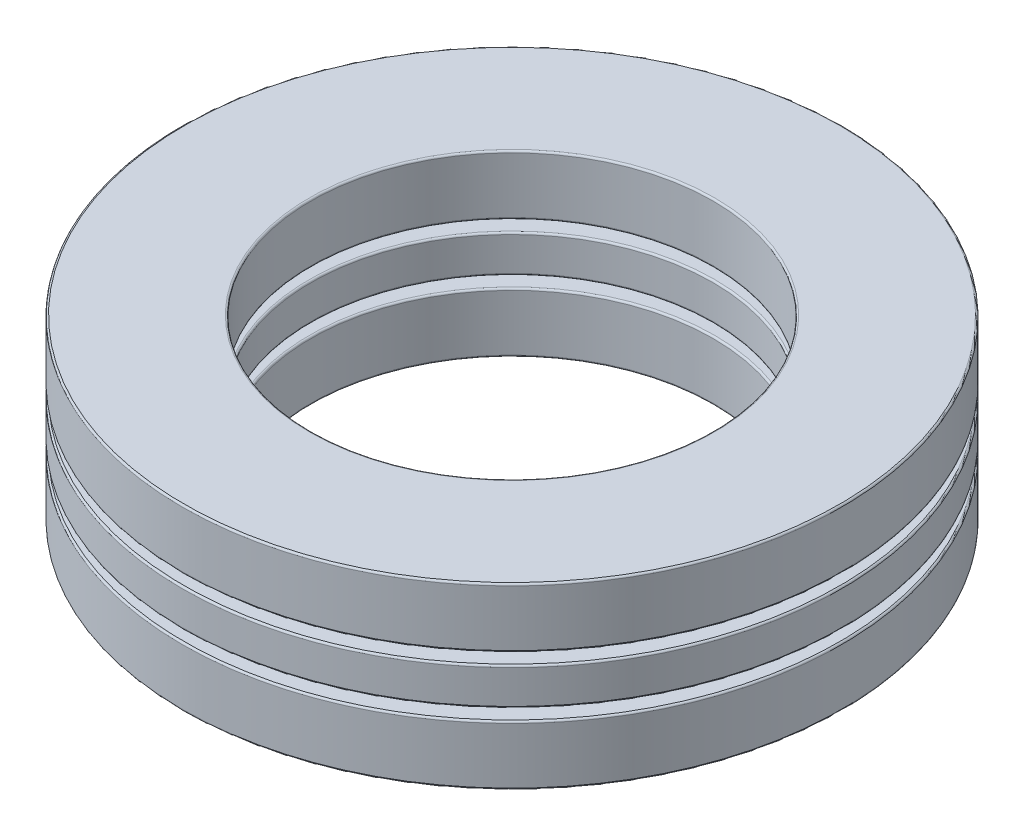
from build123d import *

# Parameters (mm, degrees)
SKETCH1_W         = 8
SKETCH1_H         = 2.314583334
CIRPATTERN1_COUNT = 10
CIRPATTERN1_ANGLE = 324
CIRPATTERN2_COUNT = 10
SKETCH4_W         = 8
SKETCH4_H         = 3.703333333
FILLET1_R         = 0.1111
FILLET2_R         = 0.1111
FILLET3_R         = 0.1111


with BuildPart() as part:
    # Sketch1 → Revolve1 (revolve)
    with BuildSketch(Plane(origin=(0, 0, 0), x_dir=(0, 0, -1), z_dir=(1, 0, 0)), mode=Mode.PRIVATE) as revolve1_sk:
        with Locations((-16.5, 0)):
            Rectangle(SKETCH1_W, SKETCH1_H)
    revolve(revolve1_sk.sketch.rotate(Axis((0, -5.555, 0), (0, 1, 0)), 180), axis=Axis((0, -5.555, 0), (0, 1, 0)))

    # Sketch3 → Cut-Revolve1 (revolve, cut)
    with BuildSketch(Plane(origin=(0, 0, 0), x_dir=(0, 0, -1), z_dir=(1, 0, 0))):
        with BuildLine():
            Line((-16.5, 1.851666667), (-16.5, -1.851666667))
            ThreePointArc((-16.5, -1.851666667), (-18.351666667, 0), (-16.5, 1.851666667))
        make_face()
    cut_revolve1 = revolve(axis=Axis((0, 1.851666667, 16.5), (0, -1, 0)), mode=Mode.SUBTRACT)

    # CirPattern2: Cut-Revolve1 ×10 about axis
    cirpattern2_axis = Axis((0, 0, 0), (0, 1, 0))
    for i in range(1, CIRPATTERN2_COUNT):
        add(cut_revolve1.rotate(cirpattern2_axis, i * 360 / CIRPATTERN2_COUNT), mode=Mode.SUBTRACT)

    # Fillet2
    fillet2_edges = [part.edges().sort_by_distance(p)[0] for p in [
        (0, 1.157291667, 20.5),
        (0, 1.157291667, 12.5),
        (0, -1.157291667, 12.5),
        (0, -1.157291667, 20.5),
    ]]
    fillet(fillet2_edges, radius=FILLET2_R)


with BuildPart() as body_2:
    # Sketch2 → Revolve2 (revolve)
    with BuildSketch(Plane(origin=(0, 0, 0), x_dir=(0, 0, -1), z_dir=(1, 0, 0))):
        with BuildLine():
            Line((-16.5, 1.851666667), (-16.5, -1.851666667))
            ThreePointArc((-16.5, -1.851666667), (-18.351666667, 0), (-16.5, 1.851666667))
        make_face()
    revolve(axis=Axis((0, 1.851666667, 16.5), (0, -1, 0)))


with BuildPart() as cirpattern1_1:
    # CirPattern1: pattern copy
    add(body_2.part.rotate(Axis((0, 5.555, 0), (0, -1, 0)), 1 * CIRPATTERN1_ANGLE / (CIRPATTERN1_COUNT - 1)))


with BuildPart() as cirpattern1_2:
    # CirPattern1: pattern copy
    add(body_2.part.rotate(Axis((0, 5.555, 0), (0, -1, 0)), 2 * CIRPATTERN1_ANGLE / (CIRPATTERN1_COUNT - 1)))


with BuildPart() as cirpattern1_3:
    # CirPattern1: pattern copy
    add(body_2.part.rotate(Axis((0, 5.555, 0), (0, -1, 0)), 3 * CIRPATTERN1_ANGLE / (CIRPATTERN1_COUNT - 1)))


with BuildPart() as cirpattern1_4:
    # CirPattern1: pattern copy
    add(body_2.part.rotate(Axis((0, 5.555, 0), (0, -1, 0)), 4 * CIRPATTERN1_ANGLE / (CIRPATTERN1_COUNT - 1)))


with BuildPart() as cirpattern1_5:
    # CirPattern1: pattern copy
    add(body_2.part.rotate(Axis((0, 5.555, 0), (0, -1, 0)), 5 * CIRPATTERN1_ANGLE / (CIRPATTERN1_COUNT - 1)))


with BuildPart() as cirpattern1_6:
    # CirPattern1: pattern copy
    add(body_2.part.rotate(Axis((0, 5.555, 0), (0, -1, 0)), 6 * CIRPATTERN1_ANGLE / (CIRPATTERN1_COUNT - 1)))


with BuildPart() as cirpattern1_7:
    # CirPattern1: pattern copy
    add(body_2.part.rotate(Axis((0, 5.555, 0), (0, -1, 0)), 7 * CIRPATTERN1_ANGLE / (CIRPATTERN1_COUNT - 1)))


with BuildPart() as cirpattern1_8:
    # CirPattern1: pattern copy
    add(body_2.part.rotate(Axis((0, 5.555, 0), (0, -1, 0)), 8 * CIRPATTERN1_ANGLE / (CIRPATTERN1_COUNT - 1)))


with BuildPart() as cirpattern1_9:
    # CirPattern1: pattern copy
    add(body_2.part.rotate(Axis((0, 5.555, 0), (0, -1, 0)), 9 * CIRPATTERN1_ANGLE / (CIRPATTERN1_COUNT - 1)))


with BuildPart() as body_12:
    # Sketch4 → Revolve3 (revolve)
    with BuildSketch(Plane(origin=(0, 0, 0), x_dir=(0, 0, -1), z_dir=(1, 0, 0)), mode=Mode.PRIVATE) as revolve3_sk:
        with Locations((-16.5, 3.703333334)):
            Rectangle(SKETCH4_W, SKETCH4_H)
        with Locations((-16.5, -3.703333334)):
            Rectangle(SKETCH4_W, SKETCH4_H)
    revolve(revolve3_sk.sketch.rotate(Axis((0, -5.555, 0), (0, 1, 0)), 180), axis=Axis((0, -5.555, 0), (0, 1, 0)))

    # Fillet1
    fillet1_edges = [body_12.edges().sort_by_distance(p)[0] for p in [
        (0, 1.851666667, 20.5),
        (0, 1.851666667, 12.5),
        (0, 5.555, 12.5),
        (0, 5.555, 20.5),
    ]]
    fillet(fillet1_edges, radius=FILLET1_R)

    # Fillet3
    fillet3_edges = [body_12.edges().sort_by_distance(p)[0] for p in [
        (0, -5.555, 20.5),
        (0, -5.555, 12.5),
        (0, -1.851666667, 12.5),
        (0, -1.851666667, 20.5),
    ]]
    fillet(fillet3_edges, radius=FILLET3_R)


solid = Compound([part.part, body_2.part, cirpattern1_1.part, cirpattern1_2.part, cirpattern1_3.part, cirpattern1_4.part, cirpattern1_5.part, cirpattern1_6.part, cirpattern1_7.part, cirpattern1_8.part, cirpattern1_9.part, body_12.part])
